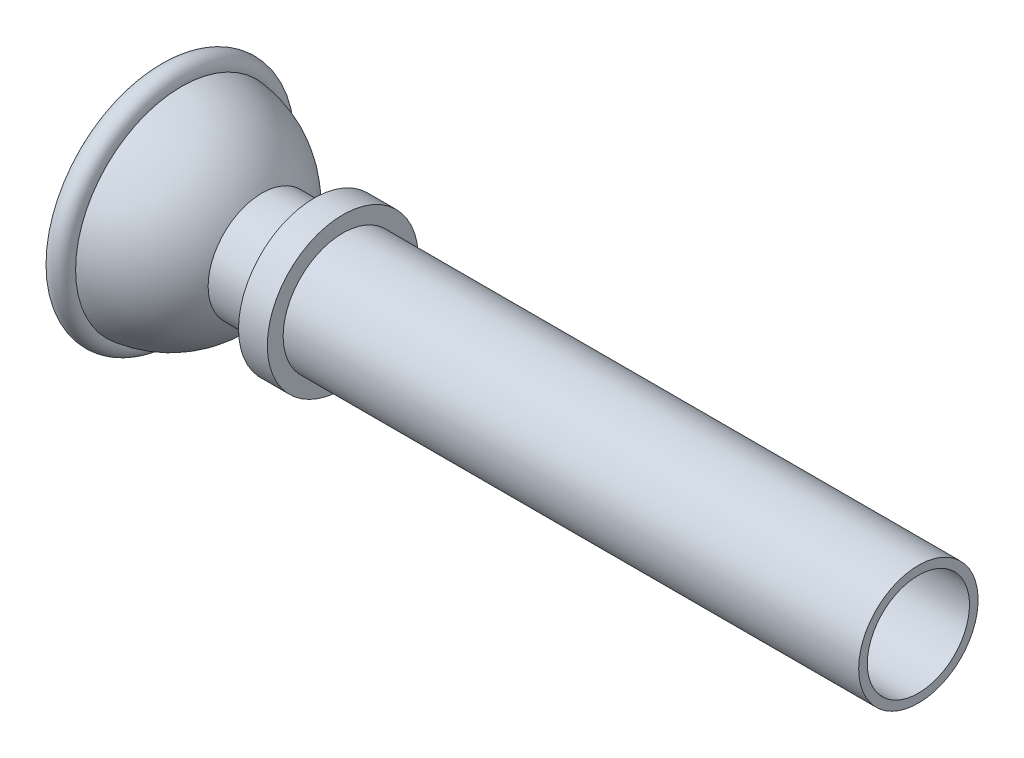
from build123d import *


with BuildPart() as part:
    # Sketch1 → Revolve1 (revolve)
    with BuildSketch(Plane.XY, mode=Mode.PRIVATE) as revolve1_sk:
        with BuildLine():
            Line((117.55898886, 6.49609803), (15.95898886, 6.49609803))
            Line((15.95898886, 6.49609803), (15.95898886, 3.82909803))
            Line((15.95898886, 3.82909803), (10.87898886, 3.82909803))
            Line((10.87898886, 3.82909803), (1.267903452, 3.82909803))
            ThreePointArc((1.267903452, 3.82909803), (-4.993471479, 11.580101966), (-14.52101114, 14.49709803))
            ThreePointArc((-14.52101114, 14.49709803), (-15.827069138, 18.085772853), (-12.519920979, 16.176022729))
            ThreePointArc((-12.519920979, 16.176022729), (-4.32104899, 13.27593718), (1.696011458, 6.996846349))
            Line((1.696011458, 6.996846349), (10.87898886, 6.996846349))
            Line((10.87898886, 6.996846349), (10.87898886, 10.81409803))
            Line((10.87898886, 10.81409803), (15.95898886, 10.81409803))
            Line((15.95898886, 10.81409803), (15.95898886, 8.02009803))
            Line((15.95898886, 8.02009803), (117.55898886, 8.02009803))
            Line((117.55898886, 8.02009803), (117.55898886, 6.49609803))
        make_face()
    revolve(revolve1_sk.sketch.rotate(Axis((-17.599665341, -2.52090197, 0), (1, 0, 0)), 90), axis=Axis((-17.599665341, -2.52090197, 0), (1, 0, 0)))


solid = part.part
